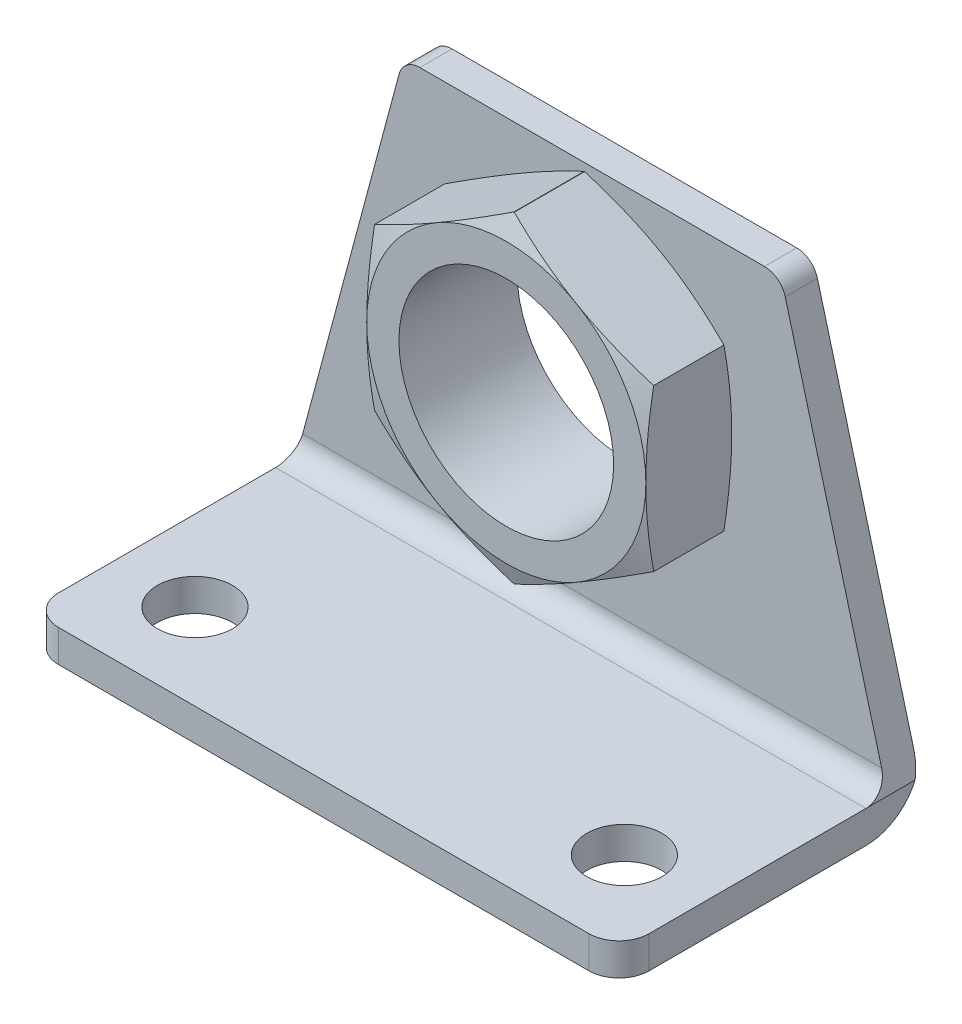
from build123d import *

# Parameters (mm, degrees)
EXTRUDE_START            = 27.5
EXTRUDE_1_DEPTH          = 55
EXTRUDE_2_DEPTH          = 8
CUT_EXTRUDE_1_DEPTH      = 55.608961566
CUT_EXTRUDE_1_DEPTH_BACK = 55.608961566
SKETCH_4_R               = 10
CUT_EXTRUDE_2_DEPTH      = 55.608961566
CUT_EXTRUDE_2_DEPTH_BACK = 55.608961566
SKETCH_6_R               = 3.5
CUT_EXTRUDE_3_DEPTH      = 54.937463789
FILLET_1_R               = 2
FILLET_2_R               = 2.8


with BuildPart() as part:
    # 草图3 → 凸台-拉伸1 (new body)
    with BuildSketch(Plane(origin=(0, 0, 0), x_dir=(0, 0, -1), z_dir=(1, 0, 0)).offset(EXTRUDE_START)):
        with BuildLine():
            Line((-28, 0), (-5, 0))
            ThreePointArc((-5, 0), (-1.464466094, 1.464466094), (0, 5))
            Line((0, 5), (0, 40))
            Line((0, 40), (-3, 40))
            Line((-3, 40), (-3, 5))
            ThreePointArc((-3, 5), (-3.585786438, 3.585786438), (-5, 3))
            Line((-5, 3), (-28, 3))
            Line((-28, 3), (-28, 0))
        make_face()
    extrude(amount=-EXTRUDE_1_DEPTH)

    # 草图7 → 凸台-拉伸2 (add)
    with BuildSketch(Plane.XY.offset(3)):
        Polygon((0, 40.011106999), (-13, 32.505553499), (-13, 17.494446501), (0, 9.988893001), (13, 17.494446501), (13, 32.505553499), align=None)
    extrude(amount=EXTRUDE_2_DEPTH)

    # 草图4 → 切除-拉伸1 (cut, two sides: drawn at the far end of the back side and taken through both)
    with BuildSketch(Plane.XY.offset(3).offset(-CUT_EXTRUDE_1_DEPTH_BACK)):
        with Locations((0, 25)):
            Circle(SKETCH_4_R)
    extrude(amount=CUT_EXTRUDE_1_DEPTH + CUT_EXTRUDE_1_DEPTH_BACK, mode=Mode.SUBTRACT)

    # 草图8 → 切除-旋转1 (revolve, cut)
    with BuildSketch(Plane(origin=(0, 25, 0), x_dir=(-1, 0, 0), z_dir=(0, 1, 0))):
        Polygon((-13, 11), (-18, 11), (-18, 9.180148829), align=None)
        Polygon((-18, 3), (-18, 4.819851171), (-13, 3), align=None)
    revolve(axis=Axis((0, 25, 0), (0, 0, 1)), mode=Mode.SUBTRACT)

    # 草图5 → 切除-拉伸2 (cut, two sides: drawn at the far end of the back side and taken through both)
    with BuildSketch(Plane.XY.offset(3).offset(-CUT_EXTRUDE_2_DEPTH_BACK)):
        Polygon((-17.58587988, 40), (-27.5, 3), (-27.5, 50), (27.5, 50), (27.5, 3), (17.58587988, 40), align=None)
    extrude(amount=CUT_EXTRUDE_2_DEPTH + CUT_EXTRUDE_2_DEPTH_BACK, mode=Mode.SUBTRACT)

    # 草图6 → 切除-拉伸3 (cut, through all)
    with BuildSketch(Plane(origin=(0, 3, 0), x_dir=(1, 0, 0), z_dir=(0, 1, 0))):
        with Locations(Location((-20, -20, 0), (0, 0, 270))):
            Circle(SKETCH_6_R)
        with Locations(Location((20, -20, 0), (0, 0, 90))):
            Circle(SKETCH_6_R)
    extrude(amount=-CUT_EXTRUDE_3_DEPTH, mode=Mode.SUBTRACT)

    # 圆角1
    fillet_1_edges = [part.edges().sort_by_distance(p)[0] for p in [
        (17.58587988, 40, 1.5),
        (-17.58587988, 40, 1.5),
    ]]
    fillet(fillet_1_edges, radius=FILLET_1_R)

    # 圆角2
    fillet_2_edges = [part.edges().sort_by_distance(p)[0] for p in [
        (27.5, 1.5, 28),
        (-27.5, 1.5, 28),
    ]]
    fillet(fillet_2_edges, radius=FILLET_2_R)


solid = part.part
